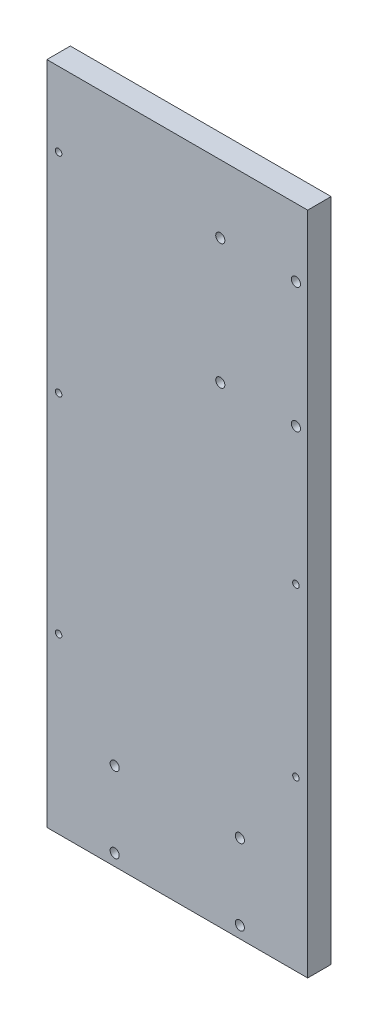
from build123d import *

# Parameters (mm, degrees)
SKETCH1_W                = 200
SKETCH1_H                = 510
BOSS_EXTRUDE1_DEPTH      = 18
F_7_0_7_DIAMETER_HOLE1_D = 7
F_5_0_5_DIAMETER_HOLE1_D = 5
F_5_0_5_DIAMETER_HOLE2_D = 5
F_7_0_7_DIAMETER_HOLE2_D = 7


with BuildPart() as part:
    # Sketch1 → Boss-Extrude1 (new body)
    with BuildSketch(Plane.XY):
        Rectangle(SKETCH1_W, SKETCH1_H)
    extrude(amount=BOSS_EXTRUDE1_DEPTH)

    # Ø7.0 (7) Diameter Hole1 (through all)
    with Locations(Plane.XY.offset(18)):
        with Locations((33, 203), (33, 107), (91, 203), (91, 107)):
            Hole(F_7_0_7_DIAMETER_HOLE1_D / 2)

    # Ø5.0 (5) Diameter Hole1 (through all)
    with Locations(Plane.XY.offset(18)):
        with Locations((-91, 198), (-91, 38), (-91, -122)):
            Hole(F_5_0_5_DIAMETER_HOLE1_D / 2)

    # Ø5.0 (5) Diameter Hole2 (through all)
    with Locations(Plane.XY.offset(18)):
        with Locations((91, 2), (91, -126)):
            Hole(F_5_0_5_DIAMETER_HOLE2_D / 2)

    # Ø7.0 (7) Diameter Hole2 (through all)
    with Locations(Plane.XY.offset(18)):
        with Locations((48, -188), (-48, -188), (48, -246), (-48, -246)):
            Hole(F_7_0_7_DIAMETER_HOLE2_D / 2)


solid = part.part
